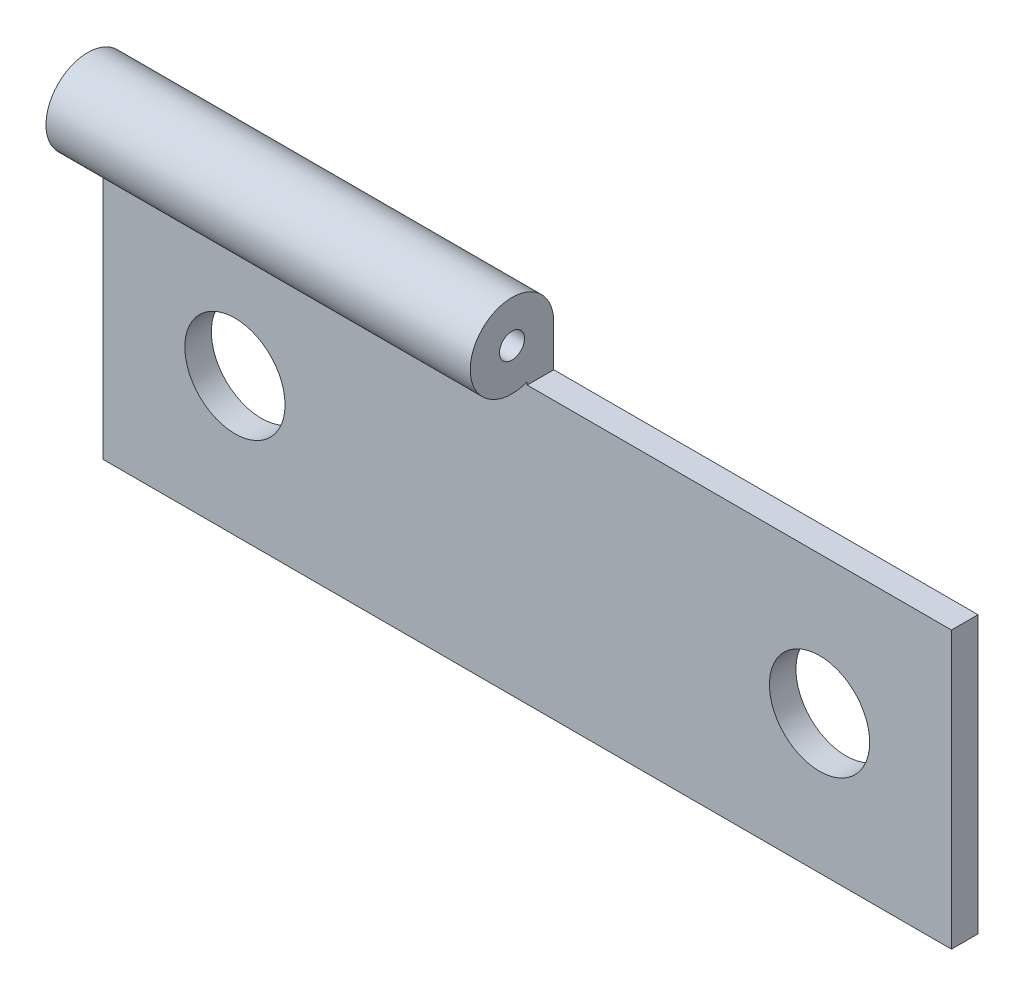
from build123d import *

# Parameters (mm, degrees)
SKETCH1_W                   = 50.8
SKETCH1_H                   = 19.05
BOSS_EXTRUDE1_DEPTH         = 1.5875
SKETCH2_R                   = 2.5
SKETCH2_R_2                 = 0.75
BOSS_EXTRUDE2_DEPTH         = 25.4
CUT_EXTRUDE2_DEPTH          = 25.4
F_6_0_MM_DOWEL_HOLES1_D     = 6
F_6_0_MM_DOWEL_HOLES1_DEPTH = 30
F_6_0_MM_DOWEL_HOLES1_TIP   = 1.802581857


with BuildPart() as part:
    # Sketch1 → Boss-Extrude1 (new body)
    with BuildSketch(Plane.XY):
        with Locations((0, 9.525)):
            Rectangle(SKETCH1_W, SKETCH1_H)
    extrude(amount=BOSS_EXTRUDE1_DEPTH)

    # Sketch2 → Boss-Extrude2 (add)
    with BuildSketch(Plane.ZY.offset(25.4)):
        with Locations((2.5, 19.05)):
            Circle(SKETCH2_R)
        with Locations((2.5, 19.05)):
            Circle(SKETCH2_R_2, mode=Mode.SUBTRACT)
    extrude(amount=-BOSS_EXTRUDE2_DEPTH)

    # Sketch3 → Cut-Extrude2 (cut)
    with BuildSketch(Plane(origin=(0, 0, 0), x_dir=(0, 0, -1), z_dir=(1, 0, 0))):
        with BuildLine():
            Line((-2.5, 16.55), (0, 16.55))
            Line((0, 16.55), (0, 19.05))
            ThreePointArc((0, 19.05), (-4.267766953, 20.817766953), (-2.5, 16.55))
        make_face()
    extrude(amount=CUT_EXTRUDE2_DEPTH, mode=Mode.SUBTRACT)

    # Ø6.0 mm Dowel Holes1
    with Locations(Plane.XY.offset(1.5875)):
        with Locations((-17.5, 8.275), (17.5, 8.275)):
            Hole(F_6_0_MM_DOWEL_HOLES1_D / 2, depth=F_6_0_MM_DOWEL_HOLES1_DEPTH)
            with Locations((0, 0, -(F_6_0_MM_DOWEL_HOLES1_DEPTH + F_6_0_MM_DOWEL_HOLES1_TIP / 2))):  # 118° drill point
                Cone(0, F_6_0_MM_DOWEL_HOLES1_D / 2, F_6_0_MM_DOWEL_HOLES1_TIP, mode=Mode.SUBTRACT)


solid = part.part
